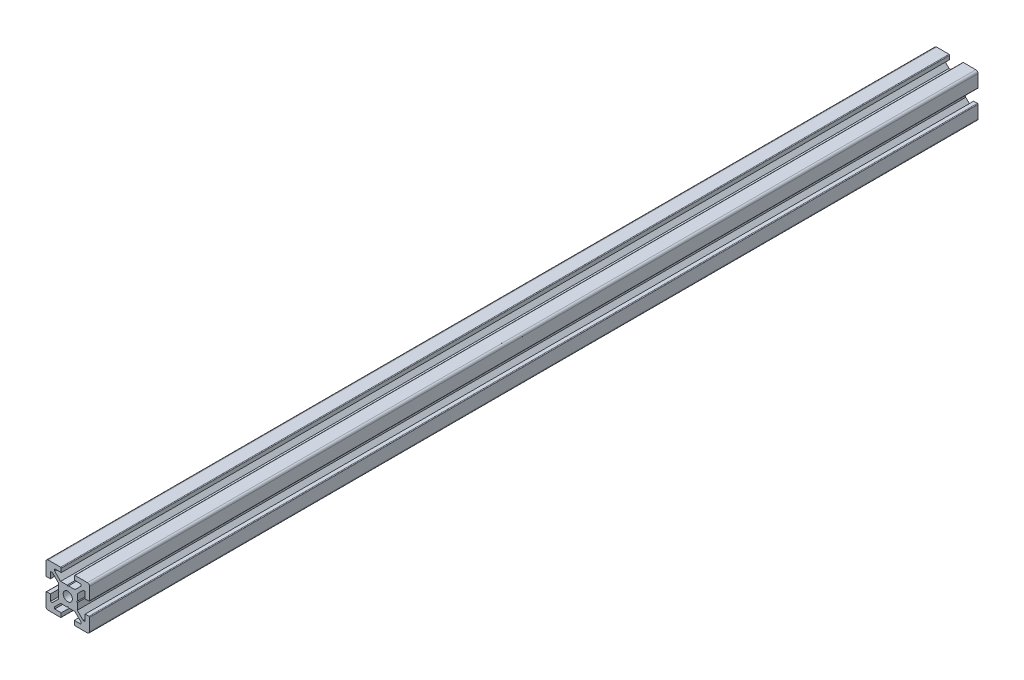
from build123d import *

# Parameters (mm, degrees)
SKETCH1_R           = 2.1
BOSS_EXTRUDE1_DEPTH = 407.86


with BuildPart() as part:
    # Sketch1 → Boss-Extrude1 (new body)
    with BuildSketch(Plane.XY):
        with BuildLine():
            Line((3.3, 4.360660172), (6.000039828, 7.0607))
            Line((6.000039828, 7.0607), (6.000039828, 8))
            Line((6.000039828, 8), (3.000039828, 8))
            Line((3.000039828, 8), (3.000039828, 9.7))
            ThreePointArc((3.000039828, 9.7), (3.087907794, 9.912132034), (3.300039828, 10))
            Line((3.300039828, 10), (9, 10))
            ThreePointArc((9, 10), (9.707106781, 9.707106781), (10, 9))
            Line((10, 9), (10, 3.300039828))
            ThreePointArc((10, 3.300039828), (9.912132034, 3.087907794), (9.7, 3.000039828))
            Line((9.7, 3.000039828), (8, 3.000039828))
            Line((8, 3.000039828), (8, 6.000039828))
            Line((8, 6.000039828), (7.0607, 6.000039828))
            Line((7.0607, 6.000039828), (4.360660172, 3.3))
            Line((4.360660172, 3.3), (4.360660172, 0.3))
            Line((4.360660172, 0.3), (4.060660172, 0))
            Line((4.060660172, 0), (4.360660172, -0.3))
            Line((4.360660172, -0.3), (4.360660172, -3.3))
            Line((4.360660172, -3.3), (7.0607, -6.000039828))
            Line((7.0607, -6.000039828), (8, -6.000039828))
            Line((8, -6.000039828), (8, -3.000039828))
            Line((8, -3.000039828), (9.7, -3.000039828))
            ThreePointArc((9.7, -3.000039828), (9.912132034, -3.087907794), (10, -3.300039828))
            Line((10, -3.300039828), (10, -9))
            ThreePointArc((10, -9), (9.707106781, -9.707106781), (9, -10))
            Line((9, -10), (3.300039828, -10))
            ThreePointArc((3.300039828, -10), (3.087907794, -9.912132034), (3.000039828, -9.7))
            Line((3.000039828, -9.7), (3.000039828, -8))
            Line((3.000039828, -8), (6.000039828, -8))
            Line((6.000039828, -8), (6.000039828, -7.0607))
            Line((6.000039828, -7.0607), (3.3, -4.360660172))
            Line((3.3, -4.360660172), (0.3, -4.360660172))
            Line((0.3, -4.360660172), (0, -4.060660172))
            Line((0, -4.060660172), (-0.3, -4.360660172))
            Line((-0.3, -4.360660172), (-3.3, -4.360660172))
            Line((-3.3, -4.360660172), (-6.000039828, -7.0607))
            Line((-6.000039828, -7.0607), (-6.000039828, -8))
            Line((-6.000039828, -8), (-3.000039828, -8))
            Line((-3.000039828, -8), (-3.000039828, -9.7))
            ThreePointArc((-3.000039828, -9.7), (-3.087907794, -9.912132034), (-3.300039828, -10))
            Line((-3.300039828, -10), (-9, -10))
            ThreePointArc((-9, -10), (-9.707106781, -9.707106781), (-10, -9))
            Line((-10, -9), (-10, -3.300039828))
            ThreePointArc((-10, -3.300039828), (-9.912132034, -3.087907794), (-9.7, -3.000039828))
            Line((-9.7, -3.000039828), (-8, -3.000039828))
            Line((-8, -3.000039828), (-8, -6.000039828))
            Line((-8, -6.000039828), (-7.0607, -6.000039828))
            Line((-7.0607, -6.000039828), (-4.360660172, -3.3))
            Line((-4.360660172, -3.3), (-4.360660172, -0.3))
            Line((-4.360660172, -0.3), (-4.060660172, 0))
            Line((-4.060660172, 0), (-4.360660172, 0.3))
            Line((-4.360660172, 0.3), (-4.360660172, 3.3))
            Line((-4.360660172, 3.3), (-7.0607, 6.000039828))
            Line((-7.0607, 6.000039828), (-8, 6.000039828))
            Line((-8, 6.000039828), (-8, 3.000039828))
            Line((-8, 3.000039828), (-9.7, 3.000039828))
            ThreePointArc((-9.7, 3.000039828), (-9.912132034, 3.087907794), (-10, 3.300039828))
            Line((-10, 3.300039828), (-10, 9))
            ThreePointArc((-10, 9), (-9.707106781, 9.707106781), (-9, 10))
            Line((-9, 10), (-3.300039828, 10))
            ThreePointArc((-3.300039828, 10), (-3.087907794, 9.912132034), (-3.000039828, 9.7))
            Line((-3.000039828, 9.7), (-3.000039828, 8))
            Line((-3.000039828, 8), (-6.000039828, 8))
            Line((-6.000039828, 8), (-6.000039828, 7.0607))
            Line((-6.000039828, 7.0607), (-3.3, 4.360660172))
            Line((-3.3, 4.360660172), (-0.3, 4.360660172))
            Line((-0.3, 4.360660172), (0, 4.060660172))
            Line((0, 4.060660172), (0.3, 4.360660172))
            Line((0.3, 4.360660172), (3.3, 4.360660172))
        make_face()
        Circle(SKETCH1_R, mode=Mode.SUBTRACT)
    extrude(amount=BOSS_EXTRUDE1_DEPTH)


solid = part.part
